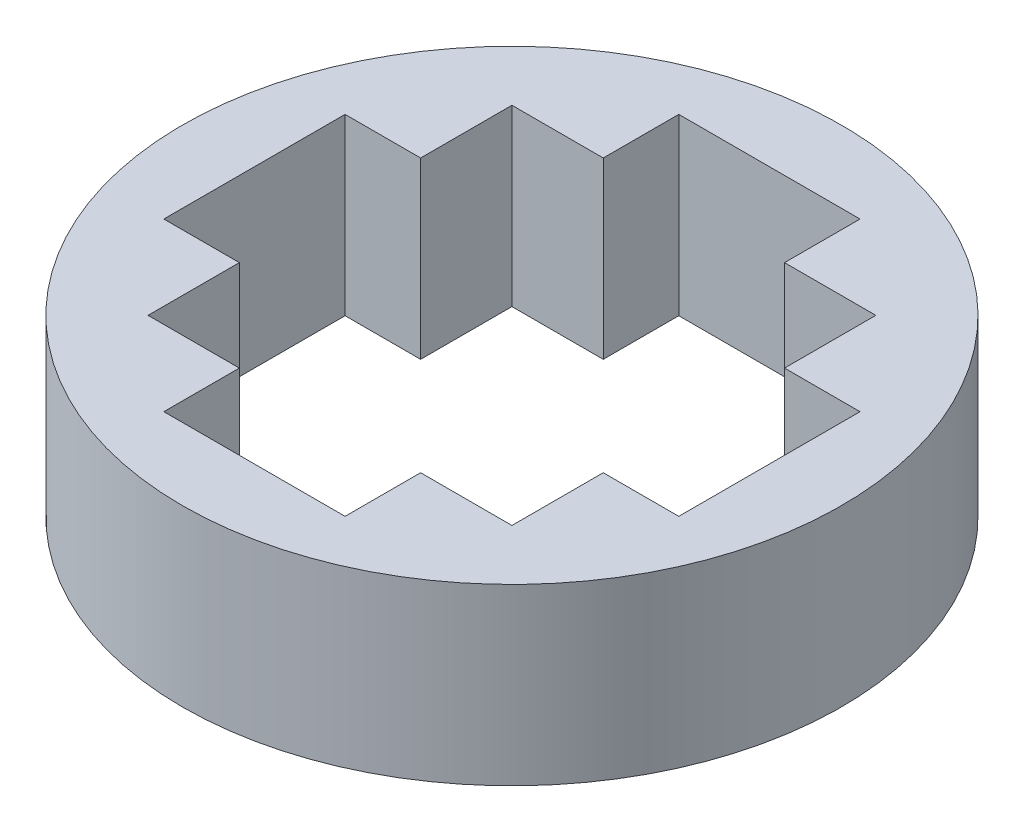
from build123d import *

# Parameters (mm, degrees)
SKETCH1_R           = 24
BOSS_EXTRUDE1_DEPTH = 6.35


with BuildPart() as part:
    # Sketch1 → Boss-Extrude1 (new, symmetric)
    with BuildSketch(Plane(origin=(0, 0, 0), x_dir=(1, 0, 0), z_dir=(0, 1, 0))):
        with Locations(Location((0, 0, 0), (0, 0, 270))):
            Circle(SKETCH1_R)
        Polygon((-6.6, 18.75), (6.6, 18.75), (6.6, 13.25), (13.25, 13.25), (13.25, 6.6), (18.75, 6.6), (18.75, -6.6), (13.25, -6.6), (13.25, -13.25), (6.6, -13.25), (6.6, -18.75), (-6.6, -18.75), (-6.6, -13.25), (-13.25, -13.25), (-13.25, -6.6), (-18.75, -6.6), (-18.75, 6.6), (-13.25, 6.6), (-13.25, 13.25), (-6.6, 13.25), align=None, mode=Mode.SUBTRACT)
    extrude(amount=BOSS_EXTRUDE1_DEPTH, both=True)


solid = part.part
